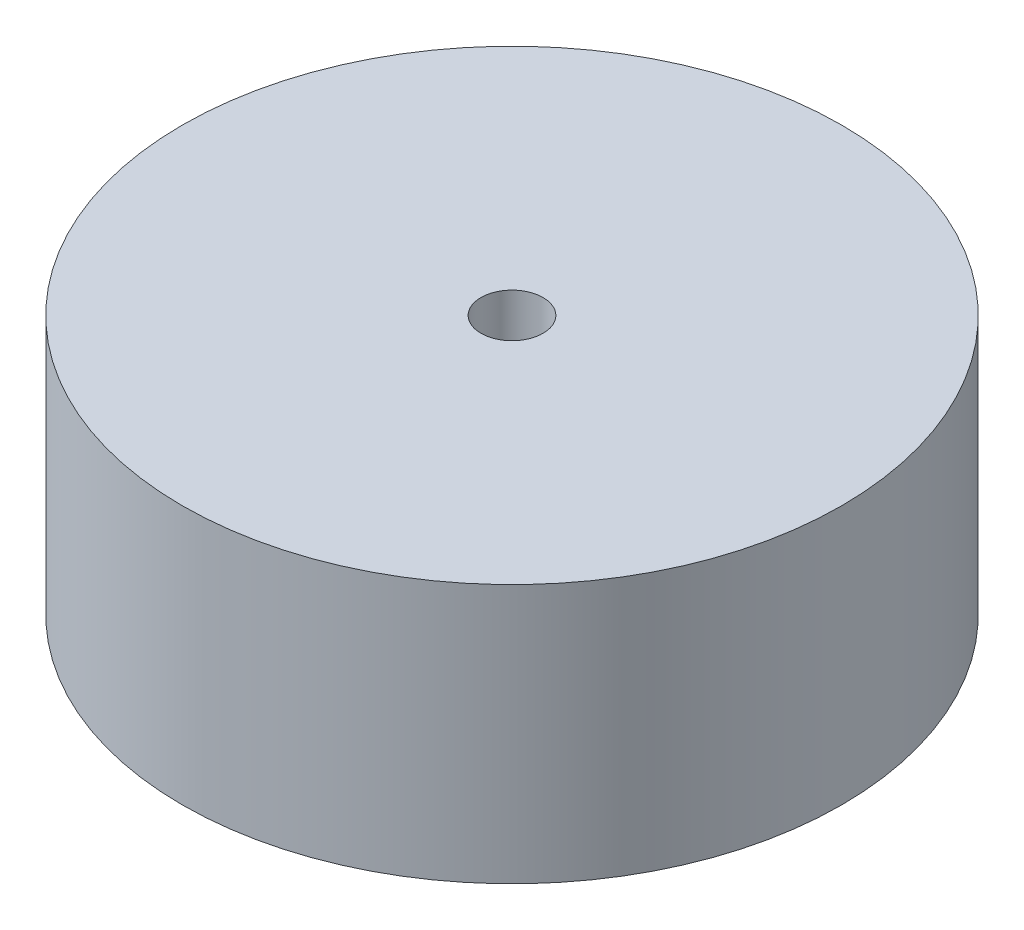
from build123d import *

# Parameters (mm, degrees)
EXTRUDE_1_DEPTH      = 16.7
EXTRUDE_1_DEPTH_BACK = 16.7
SKETCH_1_R           = 42.5
SKETCH_1_R_2         = 4


with BuildPart() as part:
    # 草圖1 → 填料-伸長1 (new, two sides: drawn at the far end of the back side and taken through both)
    with BuildSketch(Plane(origin=(0, 0, 0), x_dir=(1, 0, 0), z_dir=(0, 1, 0)).offset(-EXTRUDE_1_DEPTH_BACK)):
        Circle(SKETCH_1_R)
        Circle(SKETCH_1_R_2, mode=Mode.SUBTRACT)
    extrude(amount=EXTRUDE_1_DEPTH + EXTRUDE_1_DEPTH_BACK)


solid = part.part
